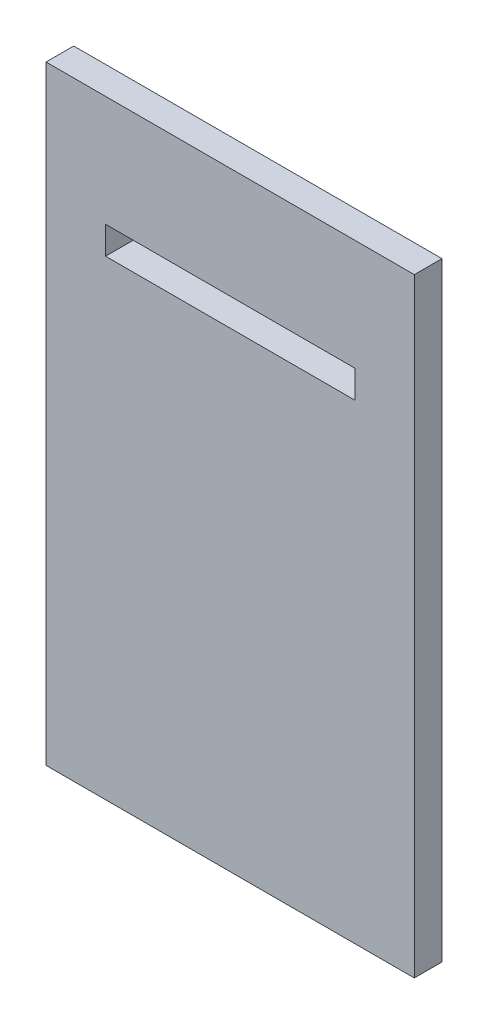
from build123d import *

# Parameters (mm, degrees)
ESQUISSE1_W        = 133
ESQUISSE1_H        = 220
ESQUISSE1_W_2      = 90
ESQUISSE1_H_2      = 10
BOSS_EXTRU_1_DEPTH = 10


with BuildPart() as part:
    # Esquisse1 → Boss.-Extru.1 (new body)
    with BuildSketch(Plane.XY):
        with Locations((66.5, 110)):
            Rectangle(ESQUISSE1_W, ESQUISSE1_H)
        with Locations((66.5, 175)):
            Rectangle(ESQUISSE1_W_2, ESQUISSE1_H_2, mode=Mode.SUBTRACT)
    extrude(amount=BOSS_EXTRU_1_DEPTH)


solid = part.part
